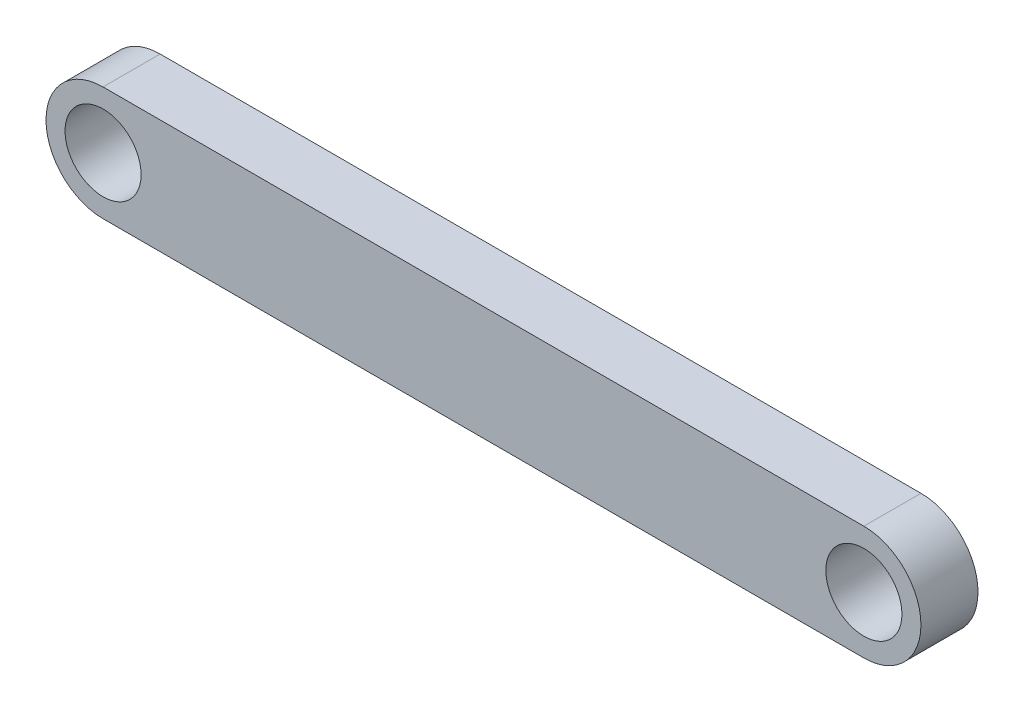
from build123d import *

# Parameters (mm, degrees)
SKETCH1_R      = 10
EXTRUDE1_DEPTH = 15


with BuildPart() as part:
    # Sketch1 → Extrude1 (new body)
    with BuildSketch(Plane.XY):
        with BuildLine():
            Line((-200, 15.05), (0, 15.05))
            ThreePointArc((0, 15.05), (15, 0.05), (0, -14.95))
            Line((0, -14.95), (-200, -14.95))
            ThreePointArc((-200, -14.95), (-215, 0.05), (-200, 15.05))
        make_face()
        with Locations((-200, 0.05)):
            Circle(SKETCH1_R, mode=Mode.SUBTRACT)
        Circle(SKETCH1_R, mode=Mode.SUBTRACT)
    extrude(amount=EXTRUDE1_DEPTH)


solid = part.part
